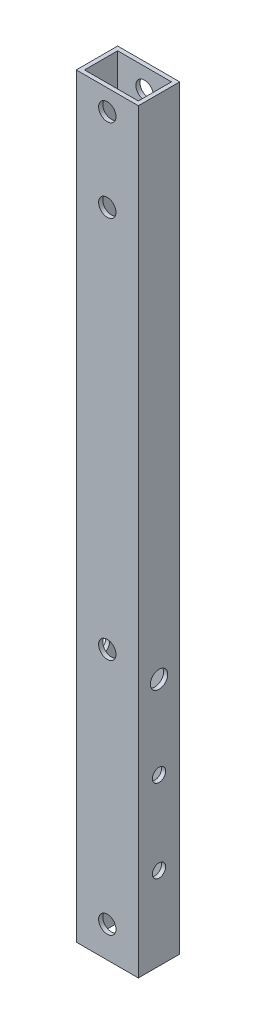
from build123d import *

# Parameters (mm, degrees)
SKETCH_1_W          = 15
SKETCH_1_H          = 10
SKETCH_1_W_2        = 13
SKETCH_1_H_2        = 8
EXTRUDE_1_DEPTH     = 182.5
SKETCH_2_R          = 2.1
CUT_EXTRUDE_1_DEPTH = 183.927581299
SKETCH_3_R          = 1.6
SKETCH_3_R_2        = 2.1
CUT_EXTRUDE_2_DEPTH = 184.183651017


with BuildPart() as part:
    # ｽｹｯﾁ1 → 押し出し-薄板1 (new body)
    with BuildSketch(Plane(origin=(0, 0, 0), x_dir=(1, 0, 0), z_dir=(0, 1, 0))):
        Rectangle(SKETCH_1_W, SKETCH_1_H)
        Rectangle(SKETCH_1_W_2, SKETCH_1_H_2, mode=Mode.SUBTRACT)
    extrude(amount=EXTRUDE_1_DEPTH)

    # ｽｹｯﾁ2 → ｶｯﾄ - 押し出し1 (cut, through all)
    with BuildSketch(Plane.XY.offset(5)):
        with Locations((0, 7.5)):
            Circle(SKETCH_2_R)
        with Locations((0, 65)):
            Circle(SKETCH_2_R)
        with Locations((0, 157.5)):
            Circle(SKETCH_2_R)
        with Locations((0, 177.5)):
            Circle(SKETCH_2_R)
    extrude(amount=-CUT_EXTRUDE_1_DEPTH, mode=Mode.SUBTRACT)

    # ｽｹｯﾁ3 → ｶｯﾄ - 押し出し2 (cut, through all)
    with BuildSketch(Plane(origin=(7.5, 0, 0), x_dir=(0, 0, -1), z_dir=(1, 0, 0))):
        with Locations((0, 20)):
            Circle(SKETCH_3_R)
        with Locations((0, 60)):
            Circle(SKETCH_3_R_2)
        with Locations((0, 40)):
            Circle(SKETCH_3_R)
    extrude(amount=-CUT_EXTRUDE_2_DEPTH, mode=Mode.SUBTRACT)


solid = part.part
